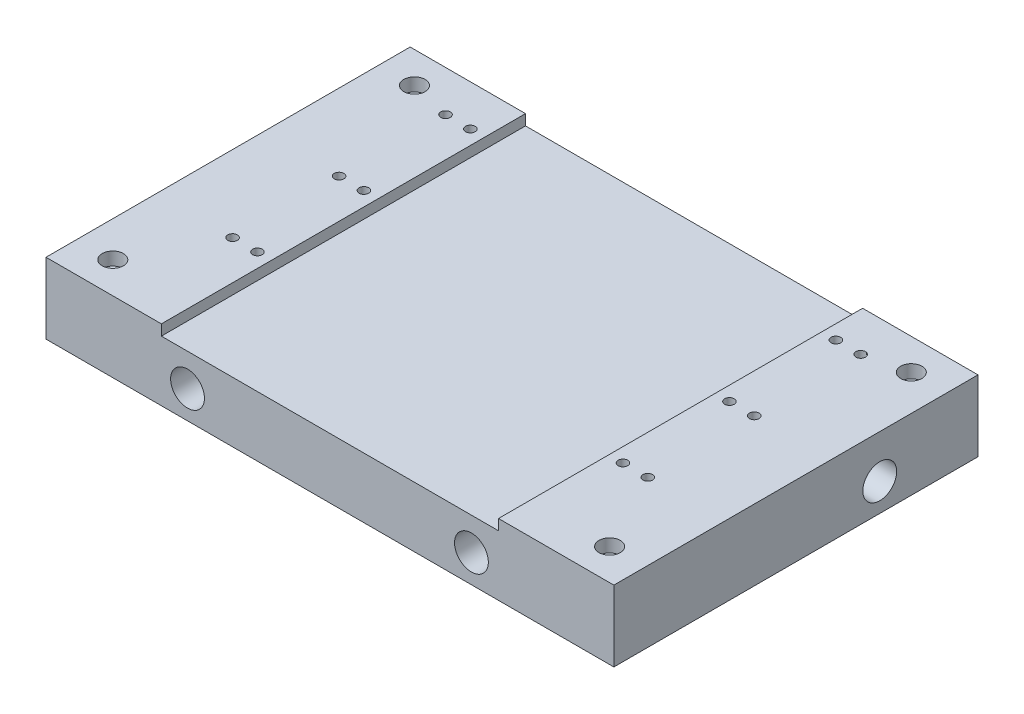
from build123d import *

# Parameters (mm, degrees)
SKETCH1_W                                      = 160.02
SKETCH1_H                                      = 102.616
BODY_DEPTH                                     = 19.9898
CBORE_FOR_6_SOCKET_HEAD_CAP_SCREW1_D           = 3.7973
CBORE_FOR_6_SOCKET_HEAD_CAP_SCREW1_CBORE_D     = 5.9944
CBORE_FOR_6_SOCKET_HEAD_CAP_SCREW1_CBORE_DEPTH = 3.683
TAP_DRILL_FOR_6_32_TAP1_D                      = 2.7051
SKETCH6_W                                      = 95
SKETCH6_H                                      = 102.616
GOUGE_DEPTH                                    = 2.9972
SKETCH7_R                                      = 4.572
PIPES1_DEPTH                                   = 80.01
SKETCH8_R                                      = 4.572
PIPES2_DEPTH                                   = 119.888
PIPE_TAP_DRILL_FOR_1_8_TAP2_D                  = 9.525
PIPE_TAP_DRILL_FOR_1_8_TAP2_DEPTH              = 20.066
PIPE_TAP_DRILL_FOR_1_8_TAP2_TIP                = 2.861598698
PIPE_TAP_DRILL_FOR_1_8_TAP3_D                  = 9.525
PIPE_TAP_DRILL_FOR_1_8_TAP3_DEPTH              = 20.066
PIPE_TAP_DRILL_FOR_1_8_TAP3_TIP                = 2.861598698


with BuildPart() as part:
    # Sketch1 → body (new body)
    with BuildSketch(Plane(origin=(0, 0, 0), x_dir=(1, 0, 0), z_dir=(0, 1, 0))):
        with Locations((80.01, 51.308)):
            Rectangle(SKETCH1_W, SKETCH1_H)
    extrude(amount=BODY_DEPTH)

    # CBORE for #6 Socket Head Cap Screw1 (through all)
    with Locations(Plane(origin=(0, 19.9898, 0), x_dir=(1, 0, 0), z_dir=(0, 1, 0))):
        with Locations((10.0076, 93.8276), (150.0124, 8.8138), (10.0076, 8.8138), (150.0124, 93.8276)):
            CounterBoreHole(CBORE_FOR_6_SOCKET_HEAD_CAP_SCREW1_D / 2, CBORE_FOR_6_SOCKET_HEAD_CAP_SCREW1_CBORE_D / 2, CBORE_FOR_6_SOCKET_HEAD_CAP_SCREW1_CBORE_DEPTH)

    # Tap Drill for #6-32 Tap1 (through all)
    with Locations(Plane(origin=(0, 19.9898, 0), x_dir=(1, 0, 0), z_dir=(0, 1, 0))):
        with Locations((28.5, 91.0844), (28.5, 31.0844), (28.5, 61.0844), (131.5, 91.0844), (131.5, 31.0844), (131.5, 61.0844), (21.5, 91.0844), (21.5, 61.0844), (21.5, 31.0844), (138.5, 31.0844), (138.5, 61.0844), (138.5, 91.0844)):
            Hole(TAP_DRILL_FOR_6_32_TAP1_D / 2)

    # Sketch6 → gouge (cut)
    with BuildSketch(Plane(origin=(0, 19.9898, 0), x_dir=(1, 0, 0), z_dir=(0, 1, 0))):
        with Locations((80.012, 51.308)):
            Rectangle(SKETCH6_W, SKETCH6_H)
    extrude(amount=-GOUGE_DEPTH, mode=Mode.SUBTRACT)

    # Sketch7 → pipes1 (cut)
    with BuildSketch(Plane.XY):
        with Locations((39.878, 7.874)):
            Circle(SKETCH7_R)
        with Locations((119.888, 7.874)):
            Circle(SKETCH7_R)
    extrude(amount=-PIPES1_DEPTH, mode=Mode.SUBTRACT)

    # Sketch8 → pipes2 (cut)
    with BuildSketch(Plane(origin=(160.02, 0, 0), x_dir=(0, 0, -1), z_dir=(1, 0, 0))):
        with Locations((74.93, 7.874)):
            Circle(SKETCH8_R)
    extrude(amount=-PIPES2_DEPTH, mode=Mode.SUBTRACT)

    # Pipe Tap Drill for 1/8 Tap2
    with Locations(Plane.XY):
        with Locations((39.878, 7.874), (119.888, 7.874)):
            Hole(PIPE_TAP_DRILL_FOR_1_8_TAP2_D / 2, depth=PIPE_TAP_DRILL_FOR_1_8_TAP2_DEPTH)
            with Locations((0, 0, -(PIPE_TAP_DRILL_FOR_1_8_TAP2_DEPTH + PIPE_TAP_DRILL_FOR_1_8_TAP2_TIP / 2))):  # 118° drill point
                Cone(0, PIPE_TAP_DRILL_FOR_1_8_TAP2_D / 2, PIPE_TAP_DRILL_FOR_1_8_TAP2_TIP, mode=Mode.SUBTRACT)

    # Pipe Tap Drill for 1/8 Tap3
    with Locations(Plane(origin=(160.02, 0, 0), x_dir=(0, 0, -1), z_dir=(1, 0, 0))):
        with Locations((74.93, 7.874)):
            Hole(PIPE_TAP_DRILL_FOR_1_8_TAP3_D / 2, depth=PIPE_TAP_DRILL_FOR_1_8_TAP3_DEPTH)
            with Locations((0, 0, -(PIPE_TAP_DRILL_FOR_1_8_TAP3_DEPTH + PIPE_TAP_DRILL_FOR_1_8_TAP3_TIP / 2))):  # 118° drill point
                Cone(0, PIPE_TAP_DRILL_FOR_1_8_TAP3_D / 2, PIPE_TAP_DRILL_FOR_1_8_TAP3_TIP, mode=Mode.SUBTRACT)


solid = part.part
